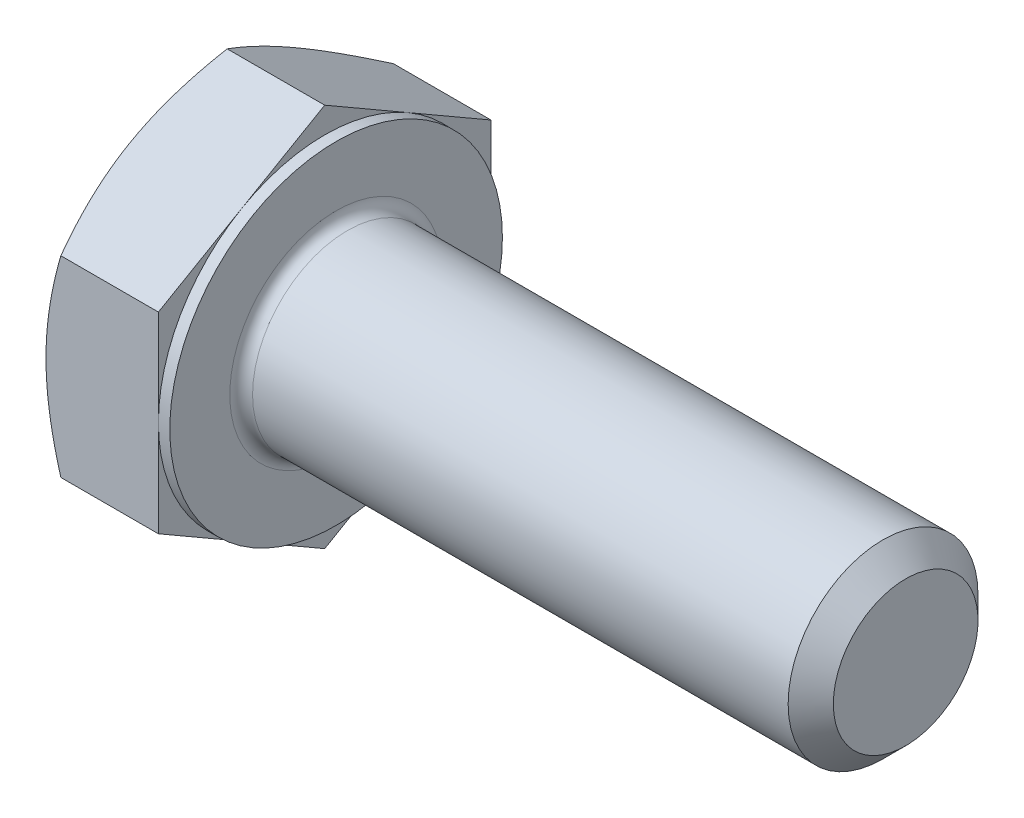
from build123d import *

# Parameters (mm, degrees)
BASEHEAD_DEPTH = 4.1402
SKETCH4_W      = 0.381
SKETCH4_H      = 26.260537215
HEADFILLET_R   = 0.381


with BuildPart() as part:
    # Sketch1 → BaseHead (new body)
    with BuildSketch(Plane(origin=(0, 0, 0), x_dir=(0, 0, -1), z_dir=(1, 0, 0))):
        Polygon((5.5626, 3.211568607), (5.5626, -3.211568607), (0, -6.423137215), (-5.5626, -3.211568607), (-5.5626, 3.211568607), (0, 6.423137215), align=None)
    extrude(amount=BASEHEAD_DEPTH)

    # BodySke → BaseBody (revolve)
    with BuildSketch(Plane.XY, mode=Mode.PRIVATE) as basebody_sk:
        Polygon((0, 0), (23.1902, 0), (23.1902, 2.41935), (22.43455, 3.175), (0, 3.175), align=None)
    revolve(basebody_sk.sketch.rotate(Axis((0, 0, 0), (1, 0, 0)), 90), axis=Axis((0, 0, 0), (1, 0, 0)))

    # Sketch3 → HeadChamfer (revolve, cut)
    with BuildSketch(Plane.XY):
        Polygon((0, 5.5626), (4.163005602, 12.773137215), (4.163005602, 19.123137215), (-12.7, 19.123137215), (-12.7, 5.5626), align=None)
    revolve(axis=Axis((0, 0, 0), (1, 0, 0)), mode=Mode.SUBTRACT)

    # Sketch4 → BearingFace (revolve, cut)
    with BuildSketch(Plane.XY, mode=Mode.PRIVATE) as bearingface_sk:
        with Locations((3.9497, 18.692868608)):
            Rectangle(SKETCH4_W, SKETCH4_H)
    revolve(bearingface_sk.sketch.rotate(Axis((0, 0, 0), (1, 0, 0)), 270), axis=Axis((0, 0, 0), (1, 0, 0)), mode=Mode.SUBTRACT)

    # HeadFillet
    headfillet_edges = [part.edges().sort_by_distance(p)[0] for p in [
        (4.1402, 0, -3.175),
    ]]
    fillet(headfillet_edges, radius=HEADFILLET_R)


solid = part.part
